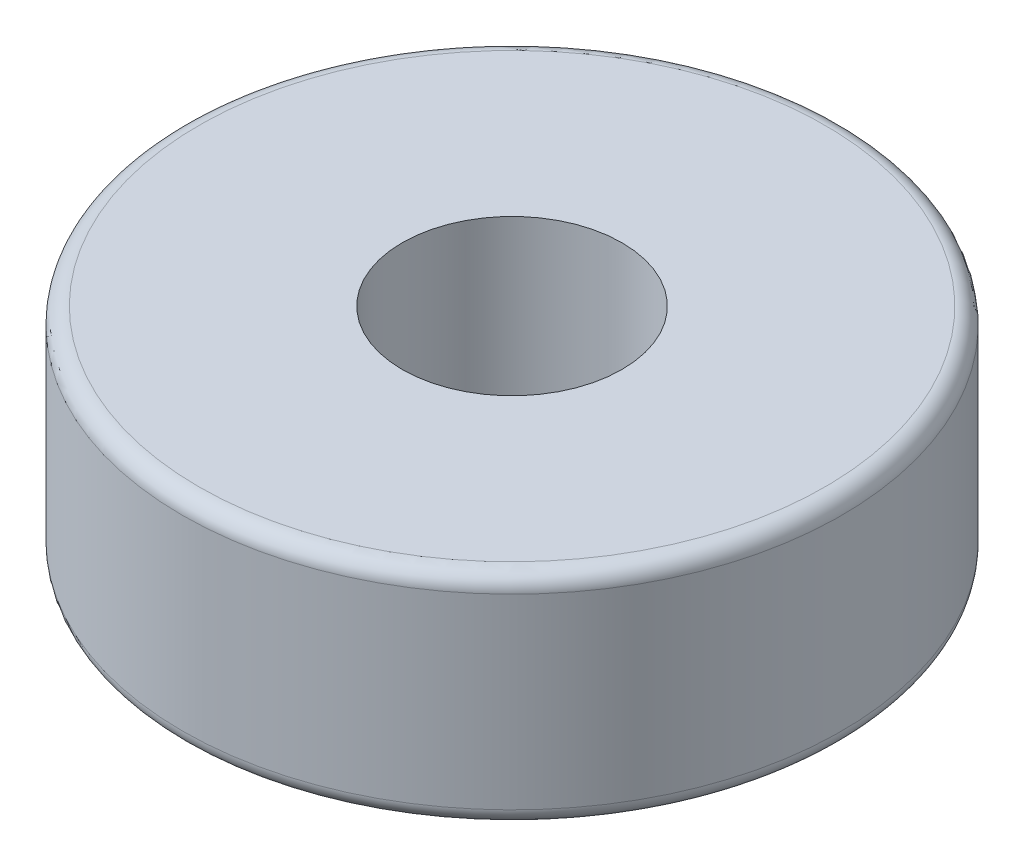
from build123d import *

# Parameters (mm, degrees)
SKETCH_1_R      = 6
SKETCH_1_R_2    = 2
EXTRUDE_1_DEPTH = 4
FILLET_1_R      = 0.3


with BuildPart() as part:
    # 草图1 → 凸台-拉伸1 (new body)
    with BuildSketch(Plane(origin=(0, 0, 0), x_dir=(1, 0, 0), z_dir=(0, 1, 0))):
        with Locations(Location((0, 0, 0), (0, 0, 270))):
            Circle(SKETCH_1_R)
        with Locations(Location((0, 0, 0), (0, 0, 270))):
            Circle(SKETCH_1_R_2, mode=Mode.SUBTRACT)
    extrude(amount=EXTRUDE_1_DEPTH)

    # 圆角1
    fillet_1_edges = [part.edges().sort_by_distance(p)[0] for p in [
        (0, 0, -6),
        (0, 4, -6),
    ]]
    fillet(fillet_1_edges, radius=FILLET_1_R)


solid = part.part
